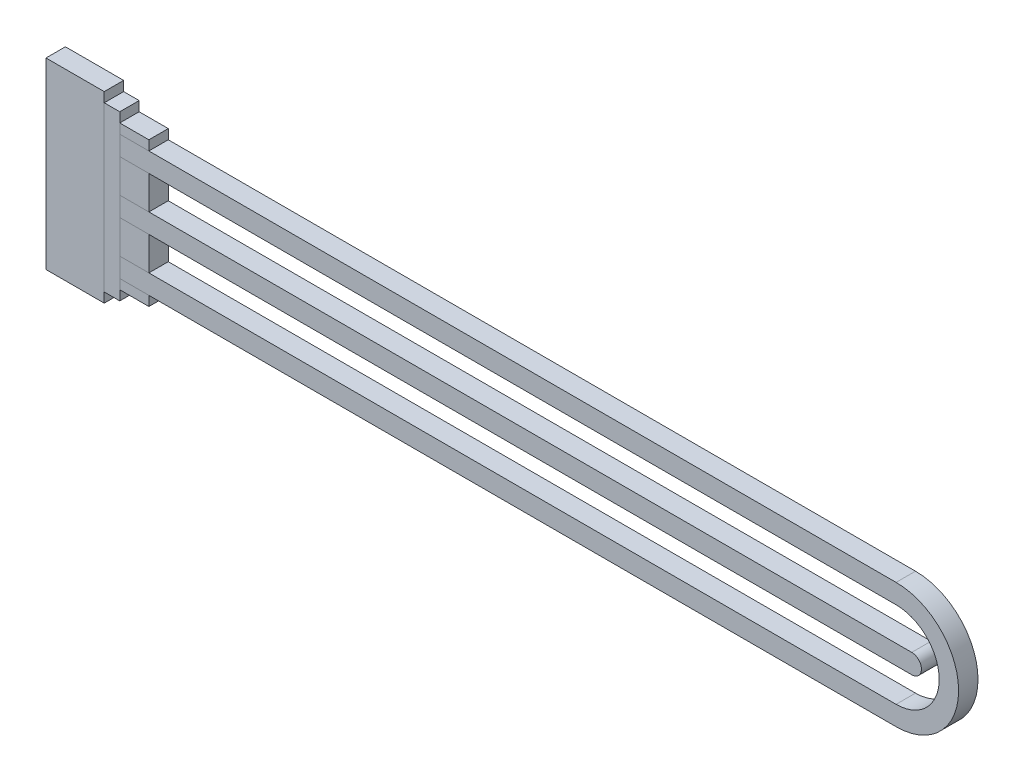
from build123d import *

# Parameters (mm, degrees)
BOSS_EXTRUDE1_DEPTH   = 10
BOSS_EXTRUDE1_2_DEPTH = 10
SKETCH2_R             = 3
BOSS_EXTRUDE2_DEPTH   = 15
SKETCH3_R             = 3
BOSS_EXTRUDE3_DEPTH   = 15
SKETCH4_W             = 10
SKETCH4_H             = 74.409684446
BOSS_EXTRUDE4_DEPTH   = 15
SKETCH5_W             = 10
SKETCH5_H             = 84.409684446
BOSS_EXTRUDE5_DEPTH   = 8
SKETCH6_W             = 10
SKETCH6_H             = 94.409684446
BOSS_EXTRUDE6_DEPTH   = 30


with BuildPart() as part:
    # Sketch1 → Boss-Extrude1 (new body)
    with BuildSketch(Plane.XY):
        with BuildLine():
            Line((0, 0), (400, 0))
            ThreePointArc((400, 0), (432.204842223, -32.204842223), (400, -64.409684446))
            Line((400, -64.409684446), (0, -64.409684446))
            Line((0, -64.409684446), (0, -54.409684446))
            Line((0, -54.409684446), (400, -54.409684446))
            ThreePointArc((400, -54.409684446), (422.204842223, -32.204842223), (400, -10))
            Line((400, -10), (0, -10))
            Line((0, -10), (0, 0))
        make_face()
    extrude(amount=BOSS_EXTRUDE1_DEPTH)


with BuildPart() as body_2:
    # Sketch1 → Boss-Extrude1 2 (new body)
    with BuildSketch(Plane.XY):
        with BuildLine():
            Line((0, -27.204842223), (408.064158914, -27.204842223))
            ThreePointArc((408.064158914, -27.204842223), (413.064158914, -32.204842223), (408.064158914, -37.204842223))
            Line((408.064158914, -37.204842223), (0, -37.204842223))
            Line((0, -37.204842223), (0, -27.204842223))
        make_face()
    extrude(amount=BOSS_EXTRUDE1_2_DEPTH)


with BuildPart() as body_3:
    # Sketch2 → Boss-Extrude2 (new body)
    with BuildSketch(Plane.ZY):
        with Locations((5, -4.906979909)):
            Circle(SKETCH2_R)
    extrude(amount=BOSS_EXTRUDE2_DEPTH)


with BuildPart() as body_4:
    # Sketch3 → Boss-Extrude3 (new body)
    with BuildSketch(Plane.ZY):
        with Locations((5, -59.409684446)):
            Circle(SKETCH3_R)
    extrude(amount=BOSS_EXTRUDE3_DEPTH)


with BuildPart() as body_5:
    # Sketch4 → Boss-Extrude4 (new body)
    with BuildSketch(Plane(origin=(0, 0, 0), x_dir=(0, 0, -1), z_dir=(1, 0, 0))):
        with Locations((-5, -32.204842223)):
            Rectangle(SKETCH4_W, SKETCH4_H)
    extrude(amount=BOSS_EXTRUDE4_DEPTH)


with BuildPart() as body_6:
    # Sketch5 → Boss-Extrude5 (new body)
    with BuildSketch(Plane.ZY):
        with Locations((5, -32.204842223)):
            Rectangle(SKETCH5_W, SKETCH5_H)
    extrude(amount=BOSS_EXTRUDE5_DEPTH)


with BuildPart() as body_7:
    # Sketch6 → Boss-Extrude6 (new body)
    with BuildSketch(Plane.ZY.offset(8)):
        with Locations((5, -32.204842223)):
            Rectangle(SKETCH6_W, SKETCH6_H)
    extrude(amount=BOSS_EXTRUDE6_DEPTH)


solid = Compound([part.part, body_2.part, body_3.part, body_4.part, body_5.part, body_6.part, body_7.part])
